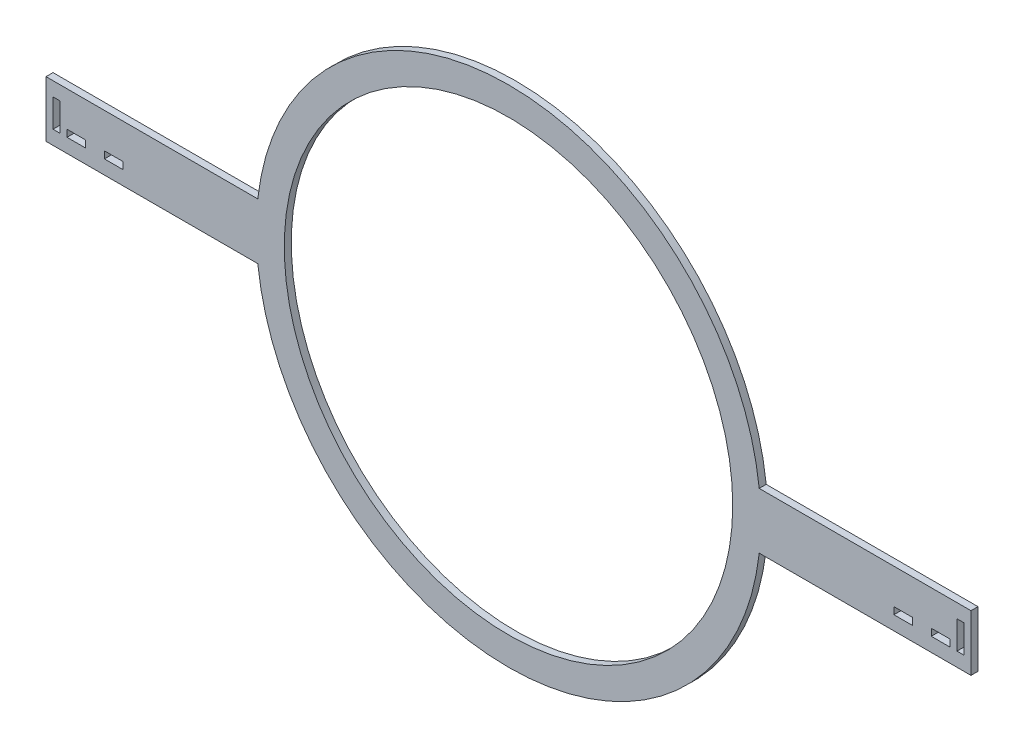
from build123d import *

# Parameters (mm, degrees)
SKETCH1_R           = 114.3
SKETCH1_R_2         = 101.6
BOSS_EXTRUDE1_DEPTH = 3.175
SKETCH2_W           = 3.175
SKETCH2_H           = 12.7
CUT_EXTRUDE1_DEPTH  = 3.175
SKETCH3_W           = 8.466666667
SKETCH3_H           = 3.175
CUT_EXTRUDE2_DEPTH  = 3.175


with BuildPart() as part:
    # Sketch1 → Boss-Extrude1 (new body)
    # profile 1 of 3: a face of its own
    with BuildSketch(Plane.XY):
        with BuildLine():
            Line((-209.55, -12.7), (-113.592253257, -12.7))
            ThreePointArc((-113.592253257, -12.7), (-114.3, 0), (-113.592253257, 12.7))
            Line((-113.592253257, 12.7), (-209.55, 12.7))
            Line((-209.55, 12.7), (-209.55, -12.7))
        make_face()
    # profile 2 of 3: a face of its own
    with BuildSketch(Plane.XY):
        Circle(SKETCH1_R)
        Circle(SKETCH1_R_2, mode=Mode.SUBTRACT)
    # profile 3 of 3: a face of its own
    with BuildSketch(Plane.XY):
        with BuildLine():
            ThreePointArc((114.3, 0), (114.122926153, -6.3598527), (113.592253257, -12.7))
            Line((113.592253257, -12.7), (209.55, -12.7))
            Line((209.55, -12.7), (209.55, 12.7))
            Line((209.55, 12.7), (113.592253257, 12.7))
            ThreePointArc((113.592253257, 12.7), (114.122926153, 6.3598527), (114.3, 0))
        make_face()
    extrude(amount=BOSS_EXTRUDE1_DEPTH)

    # Sketch2 → Cut-Extrude1 (cut)
    with BuildSketch(Plane.XY.offset(3.175)):
        with Locations((-204.7875, 0)):
            Rectangle(SKETCH2_W, SKETCH2_H)
    cut_extrude1 = extrude(amount=-CUT_EXTRUDE1_DEPTH, mode=Mode.SUBTRACT)

    # Mirror1: Cut-Extrude1 across plane
    add(cut_extrude1.mirror(Plane(origin=(0, 0, 0), x_dir=(0, 0, 1), z_dir=(1, 0, 0))), mode=Mode.SUBTRACT)

    # Sketch3 → Cut-Extrude2 (cut)
    with BuildSketch(Plane.XY.offset(3.175)):
        with Locations((195.791666667, -4.7625)):
            Rectangle(SKETCH3_W, SKETCH3_H)
        with Locations((178.858333334, -4.7625)):
            Rectangle(SKETCH3_W, SKETCH3_H)
    cut_extrude2 = extrude(amount=-CUT_EXTRUDE2_DEPTH, mode=Mode.SUBTRACT)

    # Mirror2: Cut-Extrude2 across plane
    add(cut_extrude2.mirror(Plane(origin=(0, 0, 0), x_dir=(0, 0, 1), z_dir=(1, 0, 0))), mode=Mode.SUBTRACT)


solid = part.part
